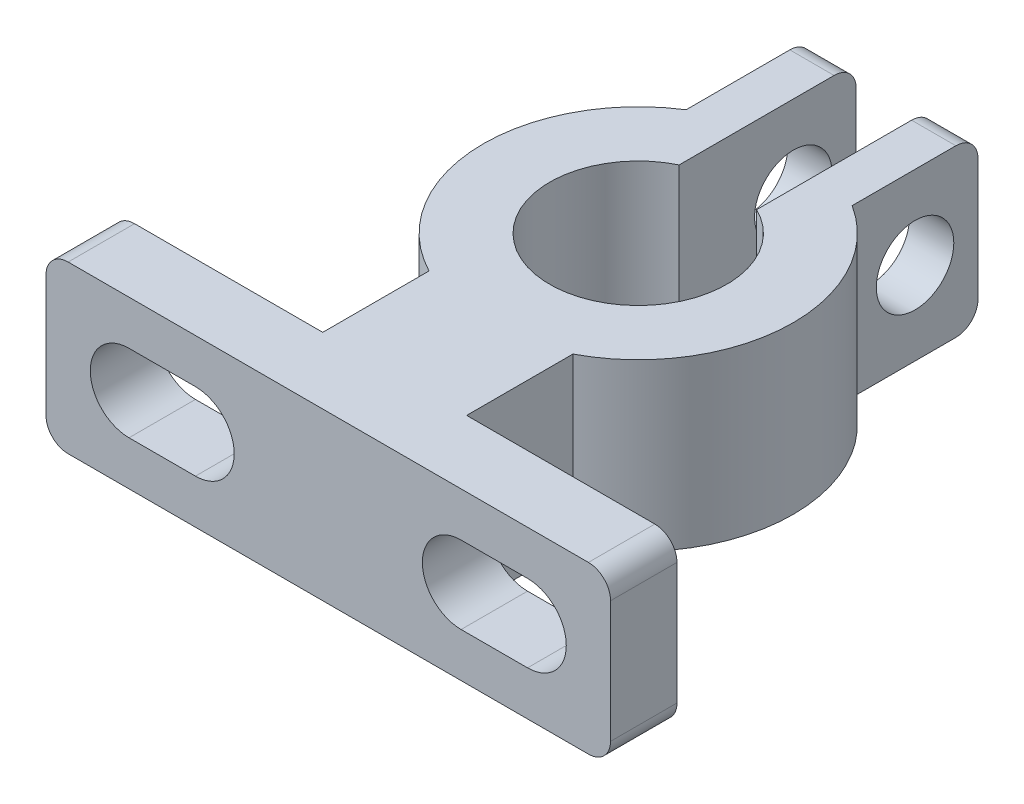
from build123d import *

# Parameters (mm, degrees)
SKETCH_1_W          = 25.5
SKETCH_1_H          = 7.5
EXTRUDE_1_DEPTH     = 3
SKETCH_2_W          = 6.5
SKETCH_2_H          = 7.5
EXTRUDE_2_DEPTH     = 7
EXTRUDE_3_DEPTH     = 3.75
SKETCH_4_R          = 1.75
CUT_EXTRUDE_1_DEPTH = 29.229969862
FILLET_1_R          = 1


with BuildPart() as part:
    # 草图1 → 凸台-拉伸1 (new body)
    with BuildSketch(Plane.XY):
        Rectangle(SKETCH_1_W, SKETCH_1_H)
        with BuildLine():
            Line((-9, 1.75), (-6, 1.75))
            ThreePointArc((-6, 1.75), (-4.25, 0), (-6, -1.75))
            Line((-6, -1.75), (-9, -1.75))
            ThreePointArc((-9, -1.75), (-10.75, 0), (-9, 1.75))
        make_face(mode=Mode.SUBTRACT)
        with BuildLine():
            Line((6, 1.75), (9, 1.75))
            ThreePointArc((9, 1.75), (10.75, 0), (9, -1.75))
            Line((9, -1.75), (6, -1.75))
            ThreePointArc((6, -1.75), (4.25, 0), (6, 1.75))
        make_face(mode=Mode.SUBTRACT)
    extrude(amount=EXTRUDE_1_DEPTH)

    # 草图2 → 凸台-拉伸2 (add)
    with BuildSketch(Plane(origin=(0, 0, 0), x_dir=(-1, 0, 0), z_dir=(0, 0, -1))):
        Rectangle(SKETCH_2_W, SKETCH_2_H)
    extrude(amount=EXTRUDE_2_DEPTH)

    # 草图3 → 凸台-拉伸3 (add, symmetric)
    with BuildSketch(Plane(origin=(0, 0, 0), x_dir=(1, 0, 0), z_dir=(0, 1, 0))):
        with BuildLine():
            Line((-3.75, 14.596873642), (-3.75, 16.910795209))
            ThreePointArc((-3.75, 16.910795209), (-3.372684391, 4.866077927), (7, 11))
            ThreePointArc((7, 11), (6.133922073, 14.372684391), (3.75, 16.910795209))
            Line((3.75, 16.910795209), (3.75, 14.596873642))
            Line((3.75, 14.596873642), (1.75, 14.596873642))
            ThreePointArc((1.75, 14.596873642), (3.391164992, 13.121320344), (4, 11))
            ThreePointArc((4, 11), (-2.121320344, 7.608835008), (-1.75, 14.596873642))
            Line((-1.75, 14.596873642), (-3.75, 14.596873642))
        make_face()
        with BuildLine():
            ThreePointArc((-1.75, 17.777720856), (-2.78395223, 17.422585926), (-3.75, 16.910795209))
            Line((-3.75, 16.910795209), (-3.75, 14.596873642))
            Line((-3.75, 14.596873642), (-1.75, 14.596873642))
            Line((-1.75, 14.596873642), (-1.75, 17.777720856))
        make_face()
        with BuildLine():
            Line((-1.75, 22.596873642), (-3.75, 22.596873642))
            Line((-3.75, 22.596873642), (-3.75, 16.910795209))
            ThreePointArc((-3.75, 16.910795209), (-2.78395223, 17.422585926), (-1.75, 17.777720856))
            Line((-1.75, 17.777720856), (-1.75, 22.596873642))
        make_face()
        with BuildLine():
            Line((1.75, 22.596873642), (1.75, 17.777720856))
            ThreePointArc((1.75, 17.777720856), (2.78395223, 17.422585926), (3.75, 16.910795209))
            Line((3.75, 16.910795209), (3.75, 22.596873642))
            Line((3.75, 22.596873642), (1.75, 22.596873642))
        make_face()
        with BuildLine():
            ThreePointArc((3.75, 16.910795209), (2.78395223, 17.422585926), (1.75, 17.777720856))
            Line((1.75, 17.777720856), (1.75, 14.596873642))
            Line((1.75, 14.596873642), (3.75, 14.596873642))
            Line((3.75, 14.596873642), (3.75, 16.910795209))
        make_face()
    extrude(amount=EXTRUDE_3_DEPTH, both=True)

    # 草图4 → 切除-拉伸1 (cut, through all)
    with BuildSketch(Plane(origin=(3.75, 0, 0), x_dir=(0, 0, -1), z_dir=(1, 0, 0))):
        with Locations((19.753834426, 0)):
            Circle(SKETCH_4_R)
    extrude(amount=-CUT_EXTRUDE_1_DEPTH, mode=Mode.SUBTRACT)

    # 圆角1
    fillet_1_edges = [part.edges().sort_by_distance(p)[0] for p in [
        (2.75, -3.75, -22.596873642),
        (2.75, 3.75, -22.596873642),
        (-2.75, -3.75, -22.596873642),
        (-2.75, 3.75, -22.596873642),
        (-12.75, -3.75, 1.5),
        (12.75, -3.75, 1.5),
        (12.75, 3.75, 1.5),
        (-12.75, 3.75, 1.5),
    ]]
    fillet(fillet_1_edges, radius=FILLET_1_R)


solid = part.part
